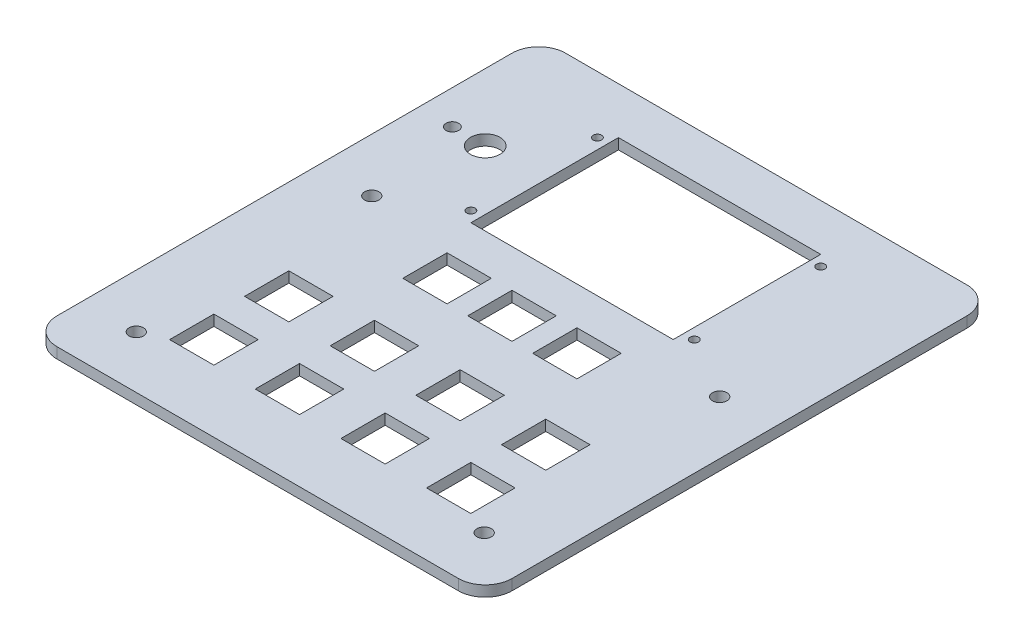
from build123d import *

# Parameters (mm, degrees)
SKETCH1_W           = 107.95
SKETCH1_H           = 120.65
SKETCH1_R           = 3.5
SKETCH1_R_2         = 1
SKETCH1_R_3         = 1.5
SKETCH1_R_4         = 1.6999966
SKETCH1_W_2         = 48
SKETCH1_H_2         = 35
SKETCH1_W_3         = 10.5
SKETCH1_H_3         = 10.5
BOSS_EXTRUDE1_DEPTH = 2.54
FILLET1_R           = 6.35


with BuildPart() as part:
    # Sketch1 → Boss-Extrude1 (new body)
    with BuildSketch(Plane(origin=(0, 0, 0), x_dir=(1, 0, 0), z_dir=(0, 1, 0))):
        Rectangle(SKETCH1_W, SKETCH1_H)
        with Locations(Location((-38.1, 31.75, 0), (0, 0, 270))):
            Circle(SKETCH1_R, mode=Mode.SUBTRACT)
        with Locations(Location((-26.5, 46.75, 0), (0, 0, 270))):
            Circle(SKETCH1_R_2, mode=Mode.SUBTRACT)
        with Locations(Location((26.5, 46.75, 0), (0, 0, 270))):
            Circle(SKETCH1_R_2, mode=Mode.SUBTRACT)
        with Locations(Location((26.5, 16.75, 0), (0, 0, 270))):
            Circle(SKETCH1_R_2, mode=Mode.SUBTRACT)
        with Locations(Location((-26.5, 16.75, 0), (0, 0, 270))):
            Circle(SKETCH1_R_2, mode=Mode.SUBTRACT)
        with Locations(Location((-45.9, 31.75, 0), (0, 0, 270))):
            Circle(SKETCH1_R_3, mode=Mode.SUBTRACT)
        with Locations(Location((-41.275, 8.007058824, 0), (0, 0, 270))):
            Circle(SKETCH1_R_4, mode=Mode.SUBTRACT)
        with Locations(Location((41.275, 8.007058824, 0), (0, 0, 270))):
            Circle(SKETCH1_R_4, mode=Mode.SUBTRACT)
        with Locations(Location((41.275, -47.872941176, 0), (0, 0, 270))):
            Circle(SKETCH1_R_4, mode=Mode.SUBTRACT)
        with Locations(Location((-41.275, -47.872941176, 0), (0, 0, 270))):
            Circle(SKETCH1_R_4, mode=Mode.SUBTRACT)
        with Locations((0, 31.75)):
            Rectangle(SKETCH1_W_2, SKETCH1_H_2, mode=Mode.SUBTRACT)
        with Locations((30.48, -40.252941176)):
            Rectangle(SKETCH1_W_3, SKETCH1_H_3, mode=Mode.SUBTRACT)
        with Locations((-30.48, -22.472941176)):
            Rectangle(SKETCH1_W_3, SKETCH1_H_3, mode=Mode.SUBTRACT)
        with Locations((-10.16, -22.472941176)):
            Rectangle(SKETCH1_W_3, SKETCH1_H_3, mode=Mode.SUBTRACT)
        with Locations((10.16, -22.472941176)):
            Rectangle(SKETCH1_W_3, SKETCH1_H_3, mode=Mode.SUBTRACT)
        with Locations((30.48, -22.472941176)):
            Rectangle(SKETCH1_W_3, SKETCH1_H_3, mode=Mode.SUBTRACT)
        with Locations((10.16, -40.252941176)):
            Rectangle(SKETCH1_W_3, SKETCH1_H_3, mode=Mode.SUBTRACT)
        with Locations((-10.16, -40.252941176)):
            Rectangle(SKETCH1_W_3, SKETCH1_H_3, mode=Mode.SUBTRACT)
        with Locations((-30.48, -40.252941176)):
            Rectangle(SKETCH1_W_3, SKETCH1_H_3, mode=Mode.SUBTRACT)
        Rectangle(SKETCH1_W_3, SKETCH1_H_3, mode=Mode.SUBTRACT)
        with Locations((-15.41, 0)):
            Rectangle(SKETCH1_W_3, SKETCH1_H_3, mode=Mode.SUBTRACT)
        with Locations((15.41, 0)):
            Rectangle(SKETCH1_W_3, SKETCH1_H_3, mode=Mode.SUBTRACT)
    extrude(amount=BOSS_EXTRUDE1_DEPTH)

    # Fillet1
    fillet1_edges = [part.edges().sort_by_distance(p)[0] for p in [
        (53.975, 1.27, 60.325),
        (-53.975, 1.27, 60.325),
        (-53.975, 1.27, -60.325),
        (53.975, 1.27, -60.325),
    ]]
    fillet(fillet1_edges, radius=FILLET1_R)


solid = part.part
